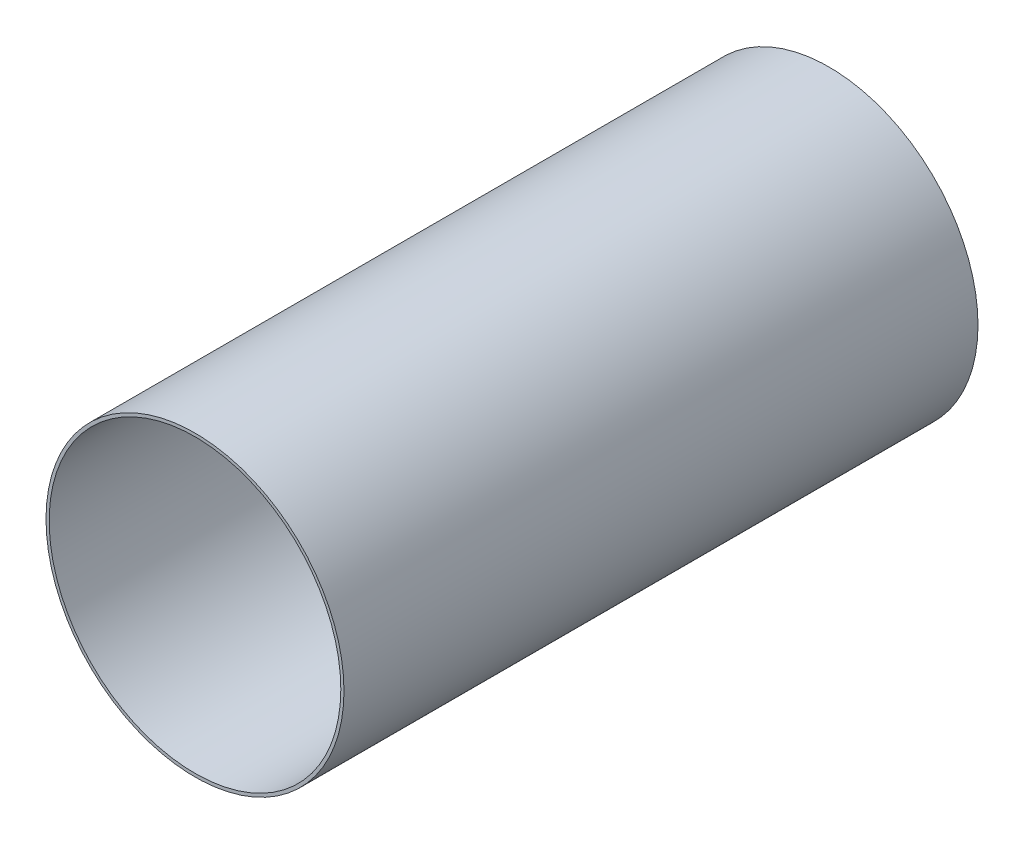
from build123d import *

# Parameters (mm, degrees)
CROQUIS1_R              = 23.5
CROQUIS1_R_2            = 23
SALIENTE_EXTRUIR1_DEPTH = 100


with BuildPart() as part:
    # Croquis1 → Saliente-Extruir1 (new body)
    with BuildSketch(Plane.XY):
        Circle(CROQUIS1_R)
        Circle(CROQUIS1_R_2, mode=Mode.SUBTRACT)
    extrude(amount=SALIENTE_EXTRUIR1_DEPTH)


solid = part.part
